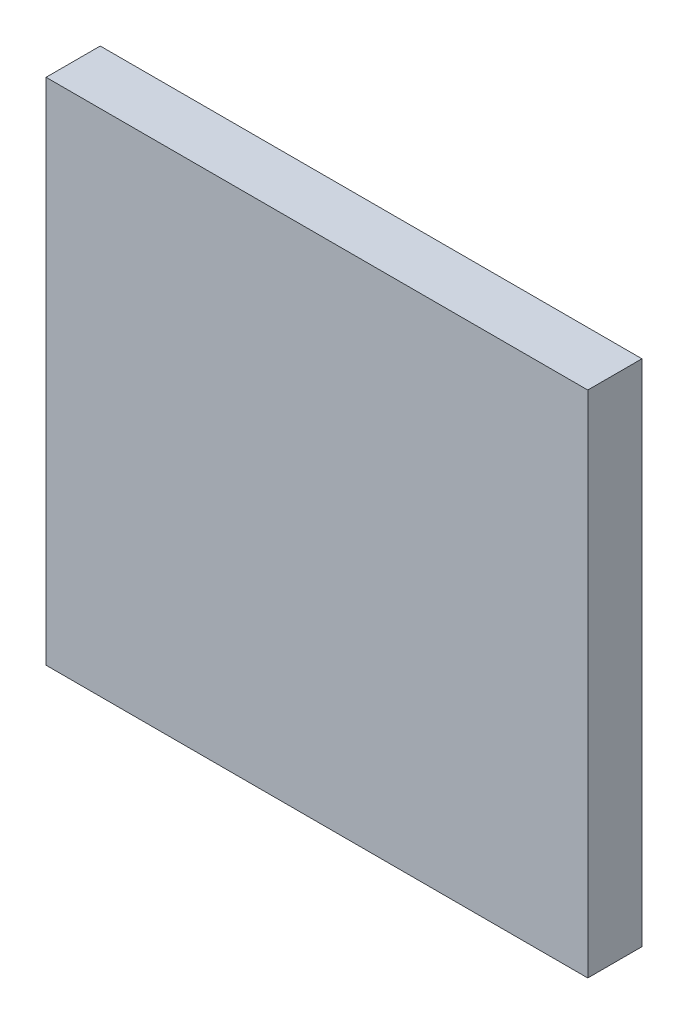
from build123d import *

# Parameters (mm, degrees)
SKETCH1_W           = 100
SKETCH1_H           = 94
BOSS_EXTRUDE1_DEPTH = 10


with BuildPart() as part:
    # Sketch1 → Boss-Extrude1 (new body)
    with BuildSketch(Plane.XY):
        Rectangle(SKETCH1_W, SKETCH1_H)
    extrude(amount=BOSS_EXTRUDE1_DEPTH)


solid = part.part
